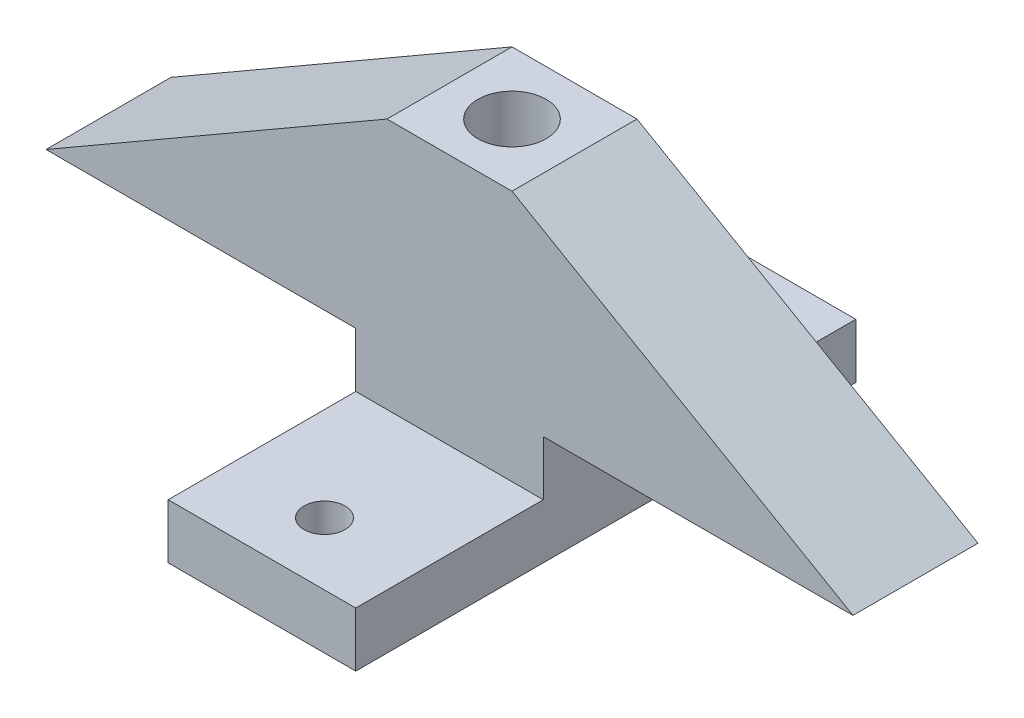
from build123d import *

# Parameters (mm, degrees)
BOSS_EXTRUDE1_DEPTH        = 25.4
SKETCH2_W                  = 38.1
SKETCH2_H                  = 11.1125
BOSS_EXTRUDE2_DEPTH        = 38.1
SKETCH3_W                  = 38.1
SKETCH3_H                  = 11.1125
BOSS_EXTRUDE3_DEPTH        = 38.1
F_0_328IN_DOWEL_HOLE1_D    = 8.3312
F_0_55IN_DOWEL_HOLE2_D     = 13.8938
F_0_55IN_DOWEL_HOLE2_DEPTH = 35.052
F_0_55IN_DOWEL_HOLE2_TIP   = 4.174118634


with BuildPart() as part:
    # Sketch1 → Boss-Extrude1 (new body)
    with BuildSketch(Plane.XY):
        Polygon((0, 0), (0, 22.225), (-62.932032303, 22.225), (6.35, 62.225), (31.75, 62.225), (101.032032303, 22.225), (38.1, 22.225), (38.1, 0), align=None)
    extrude(amount=BOSS_EXTRUDE1_DEPTH)

    # Sketch2 → Boss-Extrude2 (add)
    with BuildSketch(Plane.XY.offset(25.4)):
        with Locations((19.05, 5.55625)):
            Rectangle(SKETCH2_W, SKETCH2_H)
    extrude(amount=BOSS_EXTRUDE2_DEPTH)

    # Sketch3 → Boss-Extrude3 (add)
    with BuildSketch(Plane(origin=(0, 0, 0), x_dir=(-1, 0, 0), z_dir=(0, 0, -1))):
        with Locations((-19.05, 5.55625)):
            Rectangle(SKETCH3_W, SKETCH3_H)
    extrude(amount=BOSS_EXTRUDE3_DEPTH)

    # Ø0.328in Dowel Hole1 (through all)
    with Locations(Plane(origin=(0, 11.1125, 0), x_dir=(1, 0, 0), z_dir=(0, 1, 0))):
        with Locations((19.05, 25.4), (19.05, -50.8)):
            Hole(F_0_328IN_DOWEL_HOLE1_D / 2)

    # Ø0.55in Dowel Hole2
    with Locations(Plane(origin=(0, 62.225, 0), x_dir=(1, 0, 0), z_dir=(0, 1, 0))):
        with Locations((19.05, -12.7)):
            Hole(F_0_55IN_DOWEL_HOLE2_D / 2, depth=F_0_55IN_DOWEL_HOLE2_DEPTH)
            with Locations((0, 0, -(F_0_55IN_DOWEL_HOLE2_DEPTH + F_0_55IN_DOWEL_HOLE2_TIP / 2))):  # 118° drill point
                Cone(0, F_0_55IN_DOWEL_HOLE2_D / 2, F_0_55IN_DOWEL_HOLE2_TIP, mode=Mode.SUBTRACT)


solid = part.part
